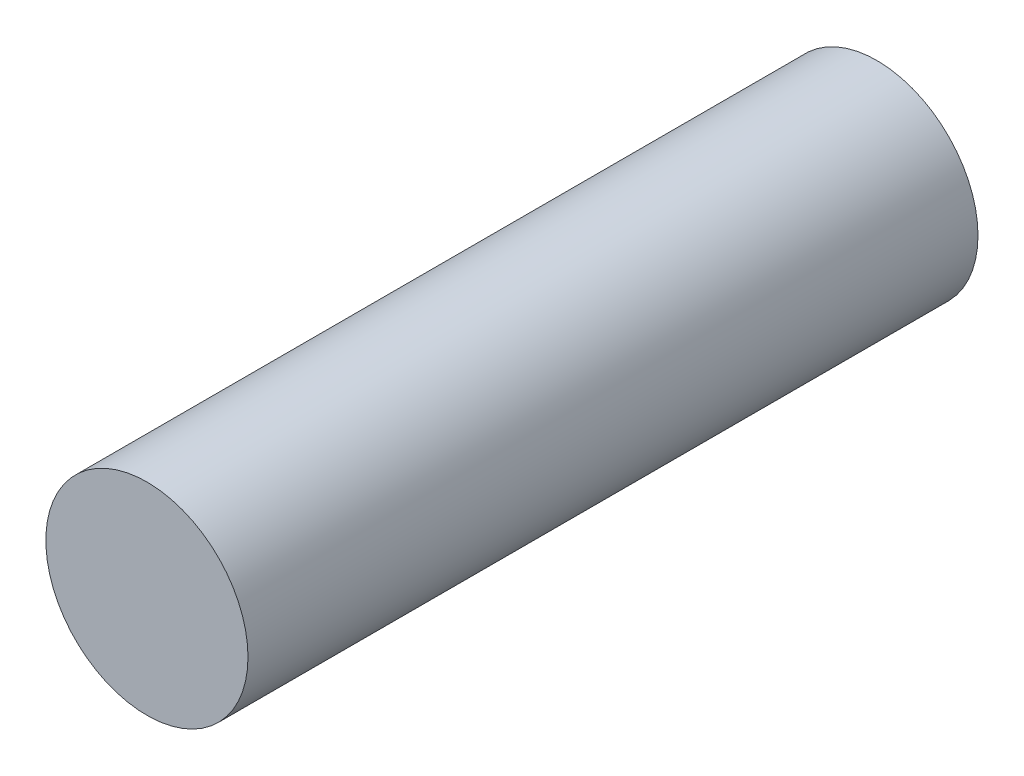
from build123d import *

# Parameters (mm, degrees)
CROQUIS1_R              = 9
SALIENTE_EXTRUIR1_DEPTH = 65


with BuildPart() as part:
    # Croquis1 → Saliente-Extruir1 (new body)
    with BuildSketch(Plane.XY):
        Circle(CROQUIS1_R)
    extrude(amount=SALIENTE_EXTRUIR1_DEPTH)


solid = part.part
